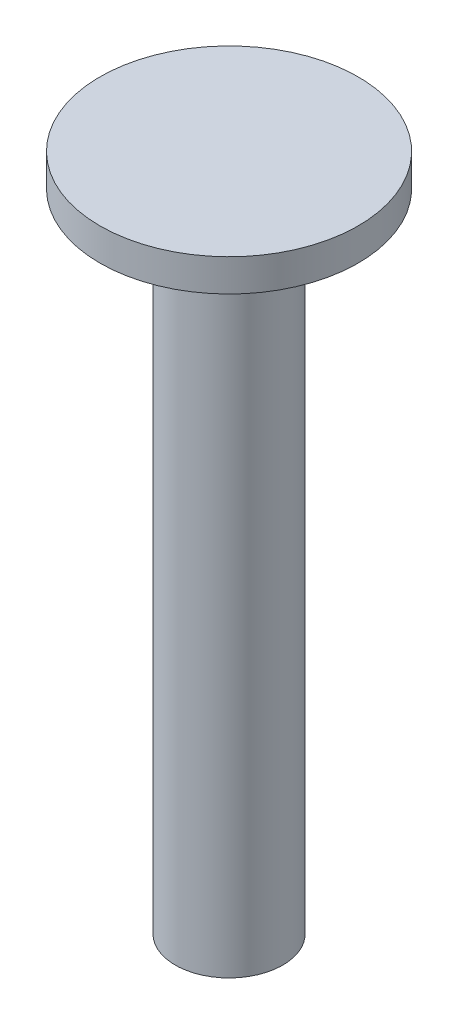
from build123d import *

# Parameters (mm, degrees)
SKETCH_1_R      = 2.4
EXTRUDE_1_DEPTH = 0.6
SKETCH_2_R      = 1
EXTRUDE_2_DEPTH = 12


with BuildPart() as part:
    # 草图1 → 凸台-拉伸1 (new body)
    with BuildSketch(Plane(origin=(0, 0, 0), x_dir=(1, 0, 0), z_dir=(0, 1, 0))):
        with Locations(Location((0, 0, 0), (0, 0, 270))):
            Circle(SKETCH_1_R)
    extrude(amount=EXTRUDE_1_DEPTH)

    # 草图2 → 凸台-拉伸2 (add)
    with BuildSketch(Plane.XZ):
        with Locations(Location((0, 0, 0), (0, 0, 270))):
            Circle(SKETCH_2_R)
    extrude(amount=EXTRUDE_2_DEPTH)


solid = part.part
